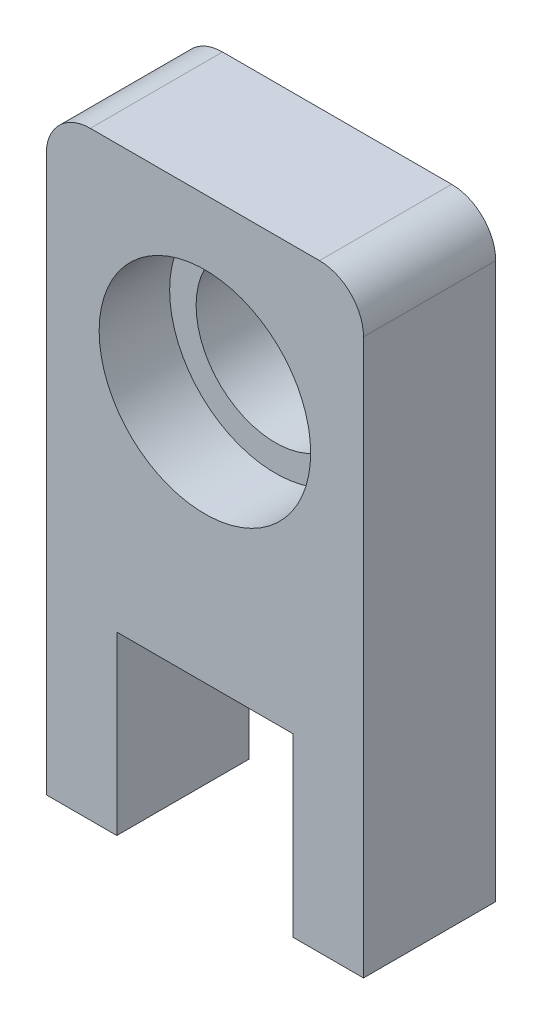
from build123d import *

# Parameters (mm, degrees)
CROQUIS1_R              = 12
SALIENTE_EXTRUIR1_DEPTH = 15
CROQUIS3_R              = 12
CROQUIS3_R_2            = 9
SALIENTE_EXTRUIR2_DEPTH = 7


with BuildPart() as part:
    # Croquis1 → Saliente-Extruir1 (new body)
    with BuildSketch(Plane.XY):
        with BuildLine():
            Line((0, -20), (0, 0))
            Line((0, 0), (20, 0))
            Line((20, 0), (20, -20))
            Line((20, -20), (28, -20))
            Line((28, -20), (28, 43))
            ThreePointArc((28, 43), (26.535533906, 46.535533906), (23, 48))
            Line((23, 48), (-3, 48))
            ThreePointArc((-3, 48), (-6.535533906, 46.535533906), (-8, 43))
            Line((-8, 43), (-8, -20))
            Line((-8, -20), (0, -20))
        make_face()
        with Locations((10, 28.6)):
            Circle(CROQUIS1_R, mode=Mode.SUBTRACT)
    extrude(amount=SALIENTE_EXTRUIR1_DEPTH)

    # Croquis3 → Saliente-Extruir2 (add)
    with BuildSketch(Plane(origin=(0, 0, 0), x_dir=(-1, 0, 0), z_dir=(0, 0, -1))):
        with Locations((-10, 28.6)):
            Circle(CROQUIS3_R)
        with Locations((-10, 28.6)):
            Circle(CROQUIS3_R_2, mode=Mode.SUBTRACT)
    extrude(amount=-SALIENTE_EXTRUIR2_DEPTH)


solid = part.part
